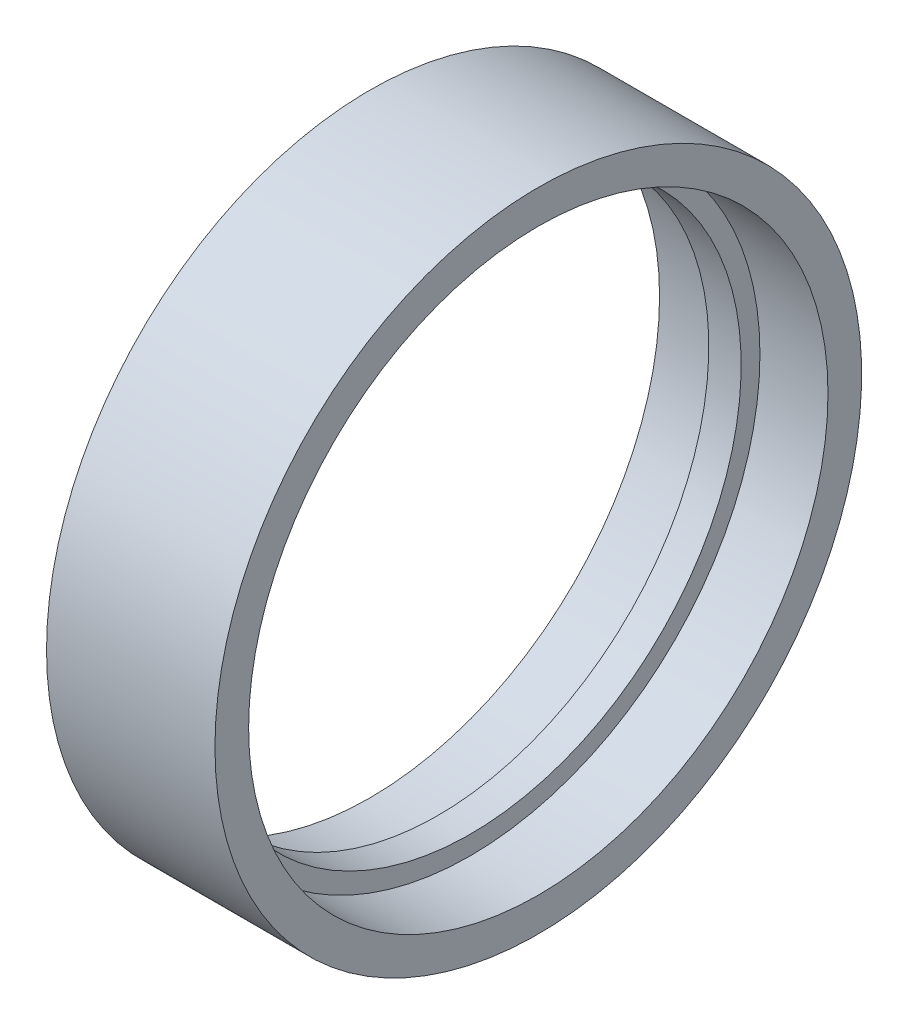
from build123d import *


with BuildPart() as part:
    # Skizze1 → Rotation1 (revolve)
    with BuildSketch(Plane.XY, mode=Mode.PRIVATE) as rotation1_sk:
        Polygon((-12.5, 48), (12.5, 48), (12.5, 43), (2.402218425, 43), (2.402218425, 40.213474445), (-2.402218425, 40.213474445), (-2.402218425, 43), (-12.5, 43), align=None)
    revolve(rotation1_sk.sketch.rotate(Axis((-14.885852911, 0, 0), (1, 0, 0)), 90), axis=Axis((-14.885852911, 0, 0), (1, 0, 0)))


solid = part.part
